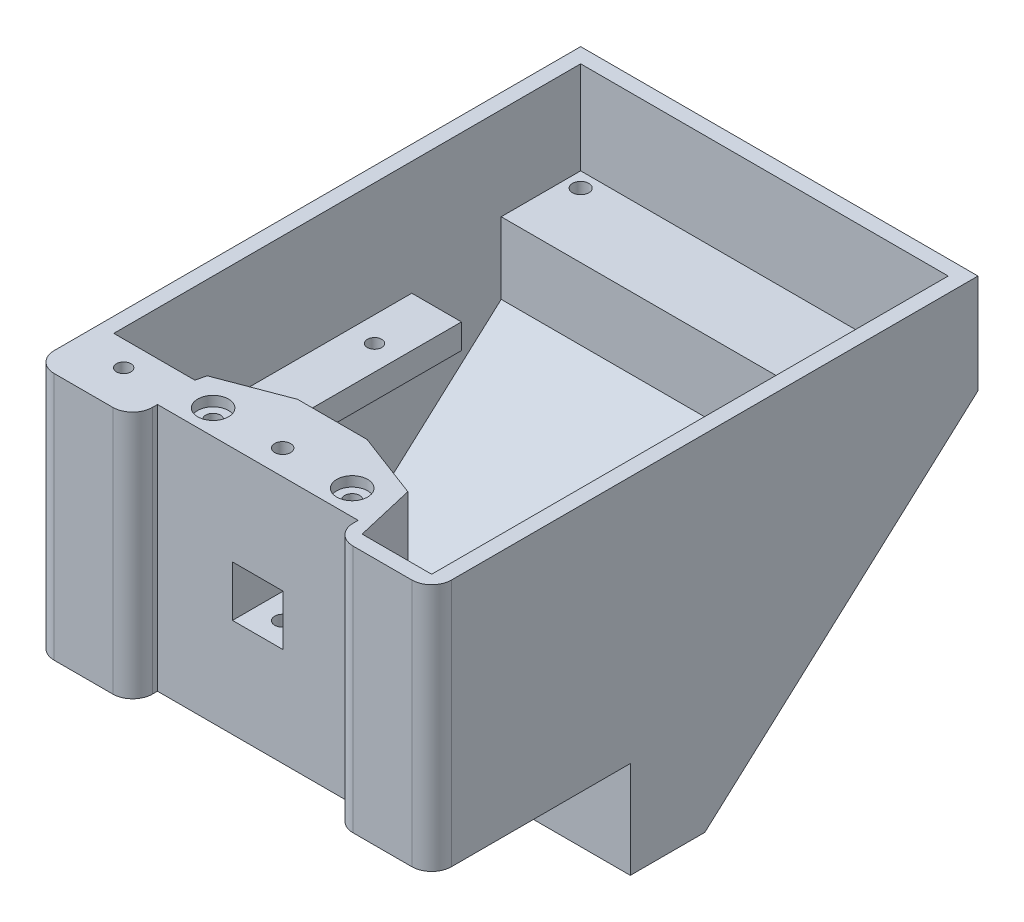
from build123d import *

# Parameters (mm, degrees)
BOSS_EXTRUDE1_DEPTH = 80
SHELL1_T            = -3
SKETCH3_W           = 46
SKETCH3_H           = 47
BOSS_EXTRUDE2_DEPTH = 17
SKETCH4_W           = 10.2
SKETCH4_H           = 10.2
CUT_EXTRUDE1_DEPTH  = 20
SKETCH6_W           = 15
SKETCH6_H           = 12.8
CUT_EXTRUDE2_DEPTH  = 3
SKETCH7_W           = 40.4
SKETCH7_H           = 50
CUT_EXTRUDE3_DEPTH  = 5
FILLET1_R           = 4
CUT_EXTRUDE7_DEPTH  = 47
SKETCH13_R          = 1.5
CUT_EXTRUDE8_DEPTH  = 25
SKETCH14_R          = 3.1
CUT_EXTRUDE9_DEPTH  = 2
SKETCH17_W          = 45
SKETCH17_H          = 5
BOSS_EXTRUDE5_DEPTH = 74
CUT_EXTRUDE10_REACH = 126.093
SKETCH18_W          = 54
SKETCH18_H          = 45
CUT_EXTRUDE11_REACH = 126.093
SKETCH19_R          = 1.45
BOSS_EXTRUDE6_DEPTH = 47
SKETCH22_R          = 1.45
CUT_EXTRUDE12_DEPTH = 135.415364765
BOSS_EXTRUDE7_DEPTH = 74
SKETCH27_R          = 1.65
CUT_EXTRUDE14_DEPTH = 10
CUT_EXTRUDE15_START = -3
CUT_EXTRUDE15_DEPTH = 32
CUT_EXTRUDE16_DEPTH = 30
BOSS_EXTRUDE8_DEPTH = 20
SKETCH31_R          = 1.5
CUT_EXTRUDE17_DEPTH = 123.649786567
CUT_EXTRUDE18_DEPTH = 15
CUT_EXTRUDE19_REACH = 126.093
SKETCH33_W          = 10
SKETCH33_H          = 5
SKETCH34_R          = 1.6
CUT_EXTRUDE20_DEPTH = 135.415364765
CUT_EXTRUDE22_DEPTH = 14


with BuildPart() as part:
    # Sketch2 → Boss-Extrude1 (new body)
    with BuildSketch(Plane(origin=(0, 0, 0), x_dir=(0, 0, -1), z_dir=(1, 0, 0))):
        Polygon((-27.320490368, 20.998248687), (-27.320490368, -29.001751313), (12.679509632, -29.001751313), (12.679509632, -48.511383538), (27.679509632, -48.511383538), (82.679509632, 0.998248687), (82.679509632, 20.998248687), align=None)
    extrude(amount=BOSS_EXTRUDE1_DEPTH)

    # Shell1
    shell1_openings = [part.faces().sort_by_distance(p)[0] for p in [
        (40, 20.998248687, -27.679509632),
    ]]
    offset(amount=SHELL1_T, openings=shell1_openings, kind=Kind.INTERSECTION)

    # Sketch3 → Boss-Extrude2 (add)
    with BuildSketch(Plane(origin=(0, 0, 24.320490368), x_dir=(-1, 0, 0), z_dir=(0, 0, -1))):
        with Locations((-40, -2.501751313)):
            Rectangle(SKETCH3_W, SKETCH3_H)
    extrude(amount=BOSS_EXTRUDE2_DEPTH)

    # Sketch4 → Cut-Extrude1 (cut)
    with BuildSketch(Plane.XY.offset(27.320490368)):
        with Locations((40, -4.001751313)):
            Rectangle(SKETCH4_W, SKETCH4_H)
    extrude(amount=-CUT_EXTRUDE1_DEPTH, mode=Mode.SUBTRACT)

    # Sketch6 → Cut-Extrude2 (cut)
    with BuildSketch(Plane.XZ.offset(29.001751313)):
        with Locations((40, 0.920490368)):
            Rectangle(SKETCH6_W, SKETCH6_H)
    extrude(amount=-CUT_EXTRUDE2_DEPTH, mode=Mode.SUBTRACT)

    # Sketch7 → Cut-Extrude3 (cut)
    with BuildSketch(Plane.XY.offset(27.320490368)):
        with Locations((40, -4.001751313)):
            Rectangle(SKETCH7_W, SKETCH7_H)
    extrude(amount=-CUT_EXTRUDE3_DEPTH, mode=Mode.SUBTRACT)

    # Fillet1
    fillet1_edges = [part.edges().sort_by_distance(p)[0] for p in [
        (80, -4.001751313, 27.320490368),
        (19.8, -4.001751313, 27.320490368),
        (0, -4.001751313, 27.320490368),
        (60.2, -4.001751313, 27.320490368),
    ]]
    fillet(fillet1_edges, radius=FILLET1_R)

    # Sketch12 → Cut-Extrude7 (cut)
    with BuildSketch(Plane(origin=(0, 20.998248687, 0), x_dir=(1, 0, 0), z_dir=(0, 1, 0))):
        Polygon((33, -7.320490368), (19.8, -12.320490368), (17, -24.320490368), (17, -7.320490368), align=None)
        Polygon((47, -7.320490368), (63, -7.320490368), (63, -24.320490368), (60.2, -12.320490368), align=None)
    extrude(amount=-CUT_EXTRUDE7_DEPTH, mode=Mode.SUBTRACT)

    # Sketch13 → Cut-Extrude8 (cut)
    with BuildSketch(Plane(origin=(0, 20.998248687, 0), x_dir=(1, 0, 0), z_dir=(0, 1, 0))):
        with Locations(Location((26, -17.320490368, 0), (0, 0, 270))):
            Circle(SKETCH13_R)
        with Locations(Location((54, -17.320490368, 0), (0, 0, 270))):
            Circle(SKETCH13_R)
    extrude(amount=-CUT_EXTRUDE8_DEPTH, mode=Mode.SUBTRACT)

    # Sketch14 → Cut-Extrude9 (cut)
    with BuildSketch(Plane(origin=(0, 20.998248687, 0), x_dir=(1, 0, 0), z_dir=(0, 1, 0))):
        with Locations(Location((26, -17.320490368, 0), (0, 0, 270))):
            Circle(SKETCH14_R)
        with Locations(Location((54, -17.320490368, 0), (0, 0, 270))):
            Circle(SKETCH14_R)
    extrude(amount=-CUT_EXTRUDE9_DEPTH, mode=Mode.SUBTRACT)

    # Sketch17 → Boss-Extrude5 (add)
    with BuildSketch(Plane.ZY.offset(-77)):
        with Locations((-23.179509632, -4.501751313)):
            Rectangle(SKETCH17_W, SKETCH17_H)
    extrude(amount=BOSS_EXTRUDE5_DEPTH)

    # Sketch18 → Cut-Extrude10 (cut, up to next)
    with BuildSketch(Plane(origin=(0, -2.001751313, 0), x_dir=(1, 0, 0), z_dir=(0, 1, 0)), mode=Mode.PRIVATE) as cut_extrude10_sk1:
        with Locations((40, 23.179509632)):
            Rectangle(SKETCH18_W, SKETCH18_H)
    cut_extrude10_tool1 = extrude(cut_extrude10_sk1.sketch, amount=-CUT_EXTRUDE10_REACH, mode=Mode.PRIVATE) & part.part
    add(cut_extrude10_tool1.solids().sort_by_distance((40, -2.001751, -23.17951))[0], mode=Mode.SUBTRACT)

    # Sketch19 → Cut-Extrude11 (cut, up to next)
    with BuildSketch(Plane(origin=(0, -2.001751313, 0), x_dir=(1, 0, 0), z_dir=(0, 1, 0)), mode=Mode.PRIVATE) as cut_extrude11_sk1:
        with Locations(Location((72, 37.179509632, 0), (0, 0, 270))):
            Circle(SKETCH19_R)
    cut_extrude11_tool1 = extrude(cut_extrude11_sk1.sketch, amount=-CUT_EXTRUDE11_REACH, mode=Mode.PRIVATE) & part.part
    # Sketch19 → Cut-Extrude11 (cut, up to next)
    with BuildSketch(Plane(origin=(0, -2.001751313, 0), x_dir=(1, 0, 0), z_dir=(0, 1, 0)), mode=Mode.PRIVATE) as cut_extrude11_sk2:
        with Locations(Location((72, 6.179509632, 0), (0, 0, 270))):
            Circle(SKETCH19_R)
    cut_extrude11_tool2 = extrude(cut_extrude11_sk2.sketch, amount=-CUT_EXTRUDE11_REACH, mode=Mode.PRIVATE) & part.part
    # Sketch19 → Cut-Extrude11 (cut, up to next)
    with BuildSketch(Plane(origin=(0, -2.001751313, 0), x_dir=(1, 0, 0), z_dir=(0, 1, 0)), mode=Mode.PRIVATE) as cut_extrude11_sk3:
        with Locations(Location((8, 33.179509632, 0), (0, 0, 270))):
            Circle(SKETCH19_R)
    cut_extrude11_tool3 = extrude(cut_extrude11_sk3.sketch, amount=-CUT_EXTRUDE11_REACH, mode=Mode.PRIVATE) & part.part
    # Sketch19 → Cut-Extrude11 (cut, up to next)
    with BuildSketch(Plane(origin=(0, -2.001751313, 0), x_dir=(1, 0, 0), z_dir=(0, 1, 0)), mode=Mode.PRIVATE) as cut_extrude11_sk4:
        with Locations(Location((8, 6.179509632, 0), (0, 0, 270))):
            Circle(SKETCH19_R)
    cut_extrude11_tool4 = extrude(cut_extrude11_sk4.sketch, amount=-CUT_EXTRUDE11_REACH, mode=Mode.PRIVATE) & part.part
    add(cut_extrude11_tool1.solids().sort_by_distance((72, -2.001751, -37.17951))[0], mode=Mode.SUBTRACT)
    add(cut_extrude11_tool2.solids().sort_by_distance((72, -2.001751, -6.17951))[0], mode=Mode.SUBTRACT)
    add(cut_extrude11_tool3.solids().sort_by_distance((8, -2.001751, -33.17951))[0], mode=Mode.SUBTRACT)
    add(cut_extrude11_tool4.solids().sort_by_distance((8, -2.001751, -6.17951))[0], mode=Mode.SUBTRACT)

    # Sketch21 → Boss-Extrude6 (add)
    with BuildSketch(Plane(origin=(0, -26.001751313, 0), x_dir=(1, 0, 0), z_dir=(0, 1, 0))):
        Polygon((3, -24.320490368), (3, -14.320490368), (19.333333333, -14.320490368), (17, -24.320490368), align=None)
    extrude(amount=BOSS_EXTRUDE6_DEPTH)

    # Sketch22 → Cut-Extrude12 (cut, through all)
    with BuildSketch(Plane(origin=(0, 20.998248687, 0), x_dir=(1, 0, 0), z_dir=(0, 1, 0))):
        with Locations(Location((10, -19.320490368, 0), (0, 0, 270))):
            Circle(SKETCH22_R)
    extrude(amount=-CUT_EXTRUDE12_DEPTH, mode=Mode.SUBTRACT)

    # Sketch26 → Boss-Extrude7 (add)
    with BuildSketch(Plane(origin=(3, 0, 0), x_dir=(0, 0, -1), z_dir=(1, 0, 0))):
        Polygon((79.679509632, 2.334161996), (63.679509632, 2.334161996), (63.679509632, -12.068640106), align=None)
    extrude(amount=BOSS_EXTRUDE7_DEPTH)

    # Sketch27 → Cut-Extrude14 (cut)
    with BuildSketch(Plane(origin=(0, 2.334161996, 0), x_dir=(1, 0, 0), z_dir=(0, 1, 0))):
        with Locations(Location((6, 76.679509632, 0), (0, 0, 270))):
            Circle(SKETCH27_R)
        with Locations(Location((74, 76.679509632, 0), (0, 0, 270))):
            Circle(SKETCH27_R)
    extrude(amount=-CUT_EXTRUDE14_DEPTH, mode=Mode.SUBTRACT)

    # Sketch28 → Cut-Extrude15 (cut)
    with BuildSketch(Plane(origin=(0, 2.334161996, 0), x_dir=(1, 0, 0), z_dir=(0, 1, 0)).offset(CUT_EXTRUDE15_START)):
        Polygon((74, 79.929509632), (71.185417438, 78.304509632), (71.185417438, 75.054509632), (74, 73.429509632), (76.814582562, 75.054509632), (76.814582562, 78.304509632), align=None)
        Polygon((6, 73.429509632), (8.814582562, 75.054509632), (8.814582562, 78.304509632), (6, 79.929509632), (3.185417438, 78.304509632), (3.185417438, 75.054509632), align=None)
    extrude(amount=-CUT_EXTRUDE15_DEPTH, mode=Mode.SUBTRACT)

    # Sketch29 → Cut-Extrude16 (cut)
    with BuildSketch(Plane.XZ.offset(29.001751313)):
        Polygon((7.185417438, 17.695490368), (10, 16.070490368), (12.814582562, 17.695490368), (12.814582562, 20.945490368), (10, 22.570490368), (7.185417438, 20.945490368), align=None)
    extrude(amount=-CUT_EXTRUDE16_DEPTH, mode=Mode.SUBTRACT)

    # Sketch30 → Boss-Extrude8 (add)
    with BuildSketch(Plane(origin=(0, -26.001751313, 0), x_dir=(1, 0, 0), z_dir=(0, 1, 0))):
        Polygon((77, -24.320490368), (63, -24.320490368), (60.2, -12.320490368), (77, -12.320490368), align=None)
    extrude(amount=BOSS_EXTRUDE8_DEPTH)

    # Sketch31 → Cut-Extrude17 (cut, through all)
    with BuildSketch(Plane(origin=(0, -6.001751313, 0), x_dir=(1, 0, 0), z_dir=(0, 1, 0))):
        with Locations(Location((72, -21.320490368, 0), (0, 0, 270))):
            Circle(SKETCH31_R)
    extrude(amount=-CUT_EXTRUDE17_DEPTH, mode=Mode.SUBTRACT)

    # Sketch32 → Cut-Extrude18 (cut)
    with BuildSketch(Plane.XZ.offset(29.001751313)):
        Polygon((72, 24.570490368), (69.185417438, 22.945490368), (69.185417438, 19.695490368), (72, 18.070490368), (74.814582562, 19.695490368), (74.814582562, 22.945490368), align=None)
    extrude(amount=-CUT_EXTRUDE18_DEPTH, mode=Mode.SUBTRACT)

    # Sketch33 → Cut-Extrude19 (cut, up to next)
    with BuildSketch(Plane(origin=(0, -2.001751313, 0), x_dir=(1, 0, 0), z_dir=(0, 1, 0)), mode=Mode.PRIVATE) as cut_extrude19_sk1:
        with Locations((72, 43.179509632)):
            Rectangle(SKETCH33_W, SKETCH33_H)
    cut_extrude19_tool1 = extrude(cut_extrude19_sk1.sketch, amount=-CUT_EXTRUDE19_REACH, mode=Mode.PRIVATE) & part.part
    add(cut_extrude19_tool1.solids().sort_by_distance((72, -2.001751, -43.17951))[0], mode=Mode.SUBTRACT)

    # Sketch34 → Cut-Extrude20 (cut, through all)
    with BuildSketch(Plane(origin=(0, 20.998248687, 0), x_dir=(1, 0, 0), z_dir=(0, 1, 0))):
        with Locations(Location((40, -17.320490368, 0), (0, 0, 270))):
            Circle(SKETCH34_R)
    extrude(amount=-CUT_EXTRUDE20_DEPTH, mode=Mode.SUBTRACT)

    # Sketch36 → Cut-Extrude22 (cut)
    with BuildSketch(Plane.XZ.offset(29.001751313)):
        Polygon((38.375, 20.13507293), (36.75, 17.320490368), (38.375, 14.505907805), (41.625, 14.505907805), (43.25, 17.320490368), (41.625, 20.13507293), align=None)
    extrude(amount=-CUT_EXTRUDE22_DEPTH, mode=Mode.SUBTRACT)


solid = part.part
